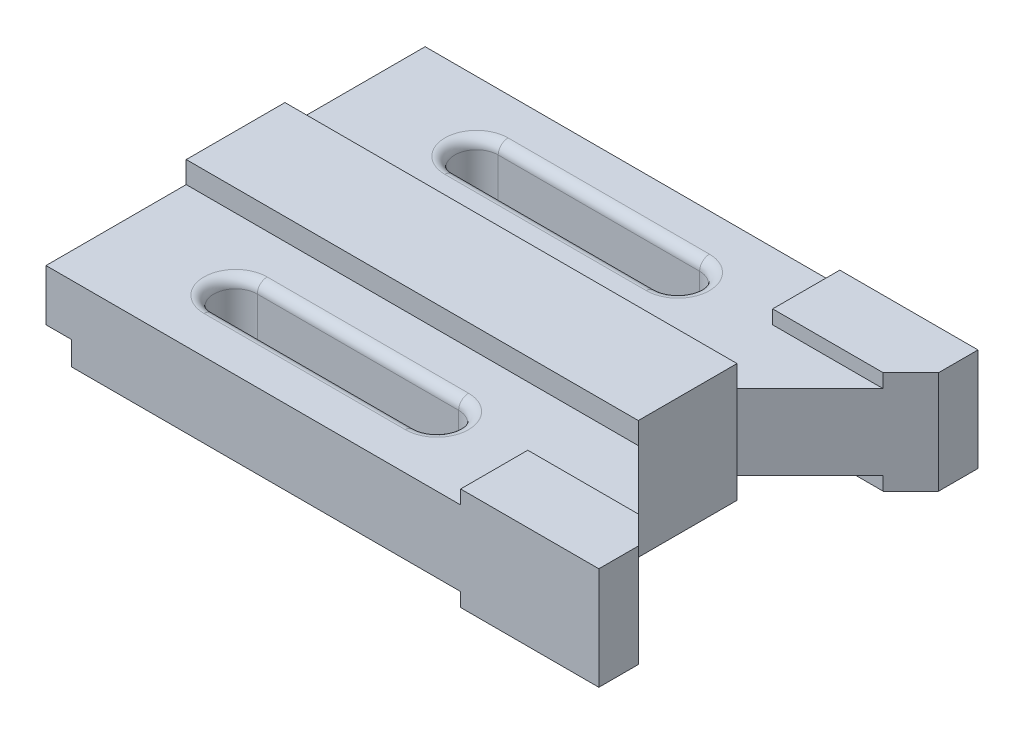
from build123d import *

# Parameters (mm, degrees)
BOSS_EXTRUDE1_DEPTH  = 19
BOSS_EXTRUDE2_DEPTH  = 3.5
BOSS_EXTRUDE3_DEPTH  = 3.5
SKETCH4_W            = 114.479344172
SKETCH4_H            = 30
BOSS_EXTRUDE4_DEPTH  = 25
CUT_EXTRUDE1_DEPTH   = 25
FILLET1_R            = 2.5
BOSS_EXTRUDE8_DEPTH  = 19
BOSS_EXTRUDE9_DEPTH  = 3.5
BOSS_EXTRUDE10_DEPTH = 3.5
CUT_EXTRUDE2_DEPTH   = 43.5
FILLET2_R            = 2.5
SKETCH13_W           = 6.5
SKETCH13_H           = 11.5
CUT_EXTRUDE4_DEPTH   = 172.520091892
SKETCH14_W           = 35.5
SKETCH14_H           = 6
CUT_EXTRUDE5_DEPTH   = 1.5


with BuildPart() as part:
    # Sketch1 → Boss-Extrude1 (new body)
    with BuildSketch(Plane(origin=(0, 0, 0), x_dir=(1, 0, 0), z_dir=(0, 1, 0))):
        Polygon((0, 0), (140, 0), (140, 10), (114.5, 35.5), (0, 35.5), align=None)
    extrude(amount=BOSS_EXTRUDE1_DEPTH)

    # Sketch2 → Boss-Extrude2 (add)
    with BuildSketch(Plane(origin=(0, 19, 0), x_dir=(1, 0, 0), z_dir=(0, 1, 0))):
        Polygon((140, 0), (105, 0), (105, 17), (133, 17), (140, 10), align=None)
    extrude(amount=BOSS_EXTRUDE2_DEPTH)

    # Sketch3 → Boss-Extrude3 (add)
    with BuildSketch(Plane.XZ):
        Polygon((140, -10), (133, -17), (105, -17), (105, 0), (140, 0), align=None)
    extrude(amount=BOSS_EXTRUDE3_DEPTH)

    # Sketch4 → Boss-Extrude4 (add)
    with BuildSketch(Plane(origin=(0, 0, -35.5), x_dir=(-1, 0, 0), z_dir=(0, 0, -1))):
        with Locations((-57.25, 9.5)):
            Rectangle(SKETCH4_W, SKETCH4_H)
    extrude(amount=BOSS_EXTRUDE4_DEPTH)

    # Sketch5 → Cut-Extrude1 (cut)
    with BuildSketch(Plane(origin=(0, 19, 0), x_dir=(1, 0, 0), z_dir=(0, 1, 0))):
        with BuildLine():
            Line((30.5, 23), (81.5, 23))
            ThreePointArc((81.5, 23), (87, 17.5), (81.5, 12))
            Line((81.5, 12), (30.5, 12))
            ThreePointArc((30.5, 12), (25, 17.5), (30.5, 23))
        make_face()
    extrude(amount=-CUT_EXTRUDE1_DEPTH, mode=Mode.SUBTRACT)

    # Fillet1
    fillet1_edges = [part.edges().sort_by_distance(p)[0] for p in [
        (56, 0, -12),
        (87, 0, -17.5),
        (56, 0, -23),
        (25, 0, -17.5),
        (25, 19, -17.5),
        (56, 19, -12),
        (87, 19, -17.5),
        (56, 19, -23),
    ]]
    fillet(fillet1_edges, radius=FILLET1_R)

    # Sketch7 → Boss-Extrude8 (add)
    with BuildSketch(Plane(origin=(0, 0, 0), x_dir=(1, 0, 0), z_dir=(0, 1, 0))):
        Polygon((0.010327914, 60.5), (0.010327914, 96), (140.010327914, 96), (140.010327914, 86), (114.510327914, 60.5), align=None)
    extrude(amount=BOSS_EXTRUDE8_DEPTH)

    # Sketch10 → Boss-Extrude9 (add)
    with BuildSketch(Plane(origin=(0, 19, 0), x_dir=(1, 0, 0), z_dir=(0, 1, 0))):
        Polygon((140.010327914, 86), (133.010327914, 79), (105.010327914, 79), (105.010327914, 96), (140.010327914, 96), align=None)
    extrude(amount=BOSS_EXTRUDE9_DEPTH)

    # Sketch11 → Boss-Extrude10 (add)
    with BuildSketch(Plane.XZ):
        Polygon((133.010327914, -79), (140.010327914, -86), (140.010327914, -96), (105.010327914, -96), (105.010327914, -79), align=None)
    extrude(amount=BOSS_EXTRUDE10_DEPTH)

    # Sketch12 → Cut-Extrude2 (cut)
    with BuildSketch(Plane.XZ):
        with BuildLine():
            Line((30.510327914, -73), (81.510327914, -73))
            ThreePointArc((81.510327914, -73), (87.010327914, -78.5), (81.510327914, -84))
            Line((81.510327914, -84), (30.510327914, -84))
            ThreePointArc((30.510327914, -84), (25.010327914, -78.5), (30.510327914, -73))
        make_face()
    extrude(amount=-CUT_EXTRUDE2_DEPTH, mode=Mode.SUBTRACT)

    # Fillet2
    fillet2_edges = [part.edges().sort_by_distance(p)[0] for p in [
        (56.010327914, 19, -84),
        (87.010327914, 19, -78.5),
        (56.010327914, 19, -73),
        (25.010327914, 19, -78.5),
        (25.010327914, 0, -78.5),
        (56.010327914, 0, -84),
        (87.010327914, 0, -78.5),
        (56.010327914, 0, -73),
    ]]
    fillet(fillet2_edges, radius=FILLET2_R)

    # Sketch13 → Cut-Extrude4 (cut, through all)
    with BuildSketch(Plane.XY):
        with Locations((3.260327914, 0.25)):
            Rectangle(SKETCH13_W, SKETCH13_H)
    extrude(amount=-CUT_EXTRUDE4_DEPTH, mode=Mode.SUBTRACT)

    # Sketch14 → Cut-Extrude5 (cut)
    with BuildSketch(Plane.ZY):
        with Locations((-17.75, 3)):
            Rectangle(SKETCH14_W, SKETCH14_H)
    extrude(amount=-CUT_EXTRUDE5_DEPTH, mode=Mode.SUBTRACT)


solid = part.part
